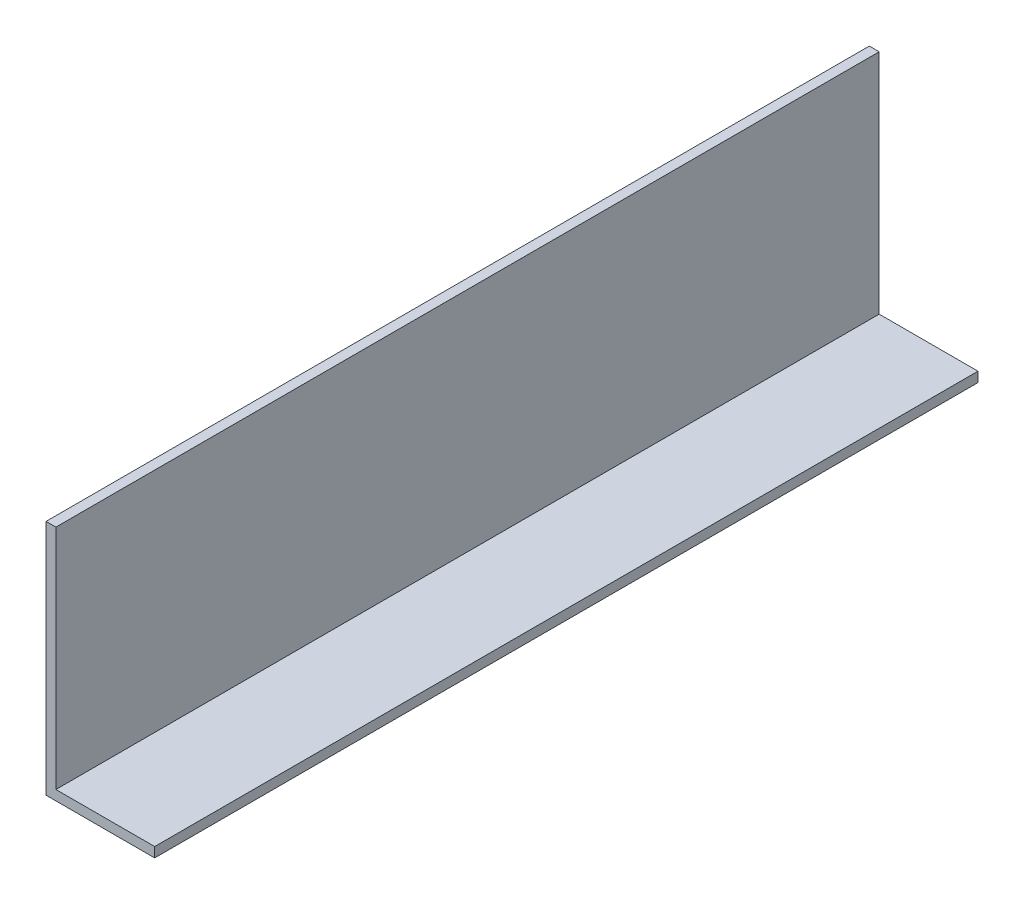
from build123d import *

# Parameters (mm, degrees)
BOSS_EXTRUDE1_DEPTH = 250


with BuildPart() as part:
    # Sketch1 → Boss-Extrude1 (new body)
    with BuildSketch(Plane.XY):
        Polygon((0, 72), (3, 72), (3, 3), (33, 3), (33, 0), (0, 0), align=None)
    extrude(amount=BOSS_EXTRUDE1_DEPTH)


solid = part.part
